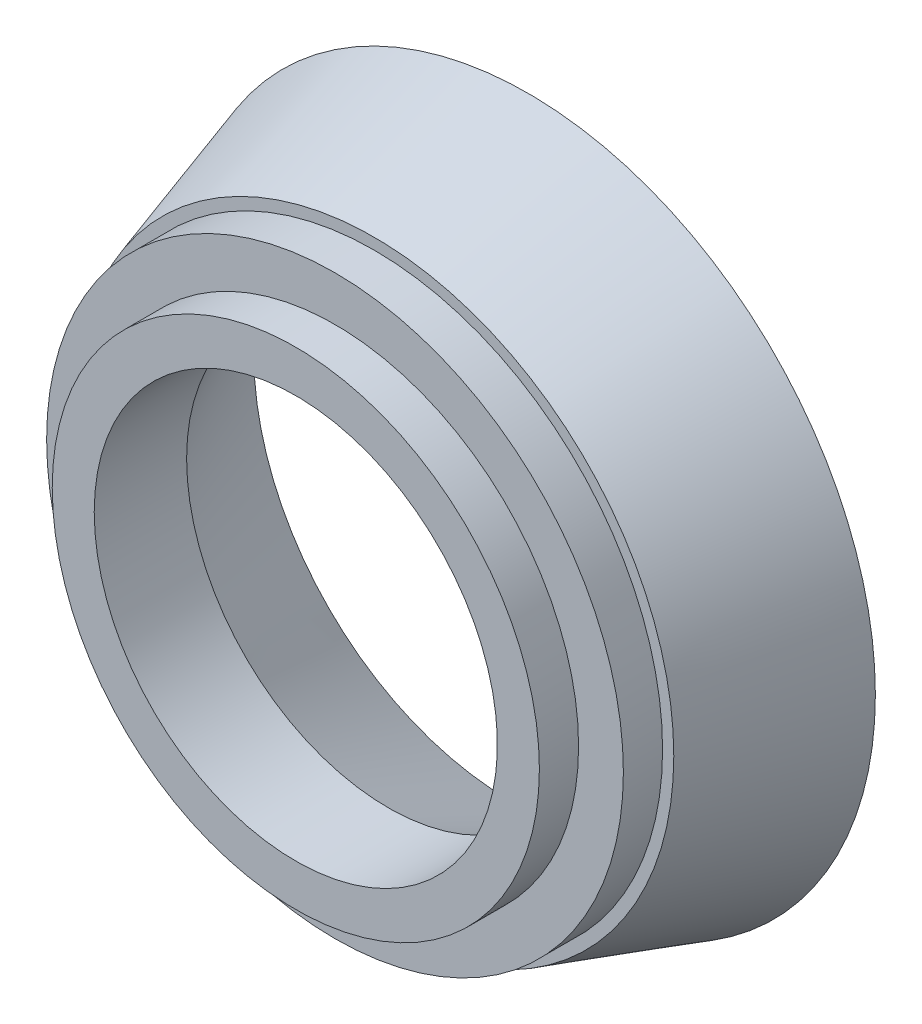
from build123d import *

# Parameters (mm, degrees)
SKETCH1_R           = 62
SKETCH2_R           = 53.5
SKETCH3_R           = 51.5
BOSS_EXTRUDE1_DEPTH = 7
SKETCH4_R           = 43.5
BOSS_EXTRUDE2_DEPTH = 7
SKETCH5_R           = 59.5
CUT_EXTRUDE1_DEPTH  = 3
SKETCH6_R           = 46
SKETCH7_R           = 36
SKETCH8_R           = 36
CUT_EXTRUDE2_DEPTH  = 92.175654809


with BuildPart() as part:
    # Sketch1 → Loft1 section 0
    with BuildSketch(Plane.XY):
        Circle(SKETCH1_R)
    # Sketch2 → Loft1 section 1
    with BuildSketch(Plane.XY.offset(27.5)):
        Circle(SKETCH2_R)
    loft()

    # Sketch3 → Boss-Extrude1 (add)
    with BuildSketch(Plane.XY.offset(27.5)):
        Circle(SKETCH3_R)
    extrude(amount=BOSS_EXTRUDE1_DEPTH)

    # Sketch4 → Boss-Extrude2 (add)
    with BuildSketch(Plane.XY.offset(34.5)):
        Circle(SKETCH4_R)
    extrude(amount=BOSS_EXTRUDE2_DEPTH)

    # Sketch5 → Cut-Extrude1 (cut)
    with BuildSketch(Plane(origin=(0, 0, 0), x_dir=(-1, 0, 0), z_dir=(0, 0, -1))):
        Circle(SKETCH5_R)
    extrude(amount=-CUT_EXTRUDE1_DEPTH, mode=Mode.SUBTRACT)

    # Sketch6 → Cut-Loft1 section 0
    with BuildSketch(Plane(origin=(0, 0, 3), x_dir=(-1, 0, 0), z_dir=(0, 0, -1))):
        Circle(SKETCH6_R)
    # Sketch7 → Cut-Loft1 section 1
    with BuildSketch(Plane(origin=(0, 0, 25), x_dir=(-1, 0, 0), z_dir=(0, 0, -1))):
        Circle(SKETCH7_R)
    loft(mode=Mode.SUBTRACT)

    # Sketch8 → Cut-Extrude2 (cut, through all)
    with BuildSketch(Plane(origin=(0, 0, 25), x_dir=(-1, 0, 0), z_dir=(0, 0, -1))):
        Circle(SKETCH8_R)
    extrude(amount=-CUT_EXTRUDE2_DEPTH, mode=Mode.SUBTRACT)


solid = part.part
